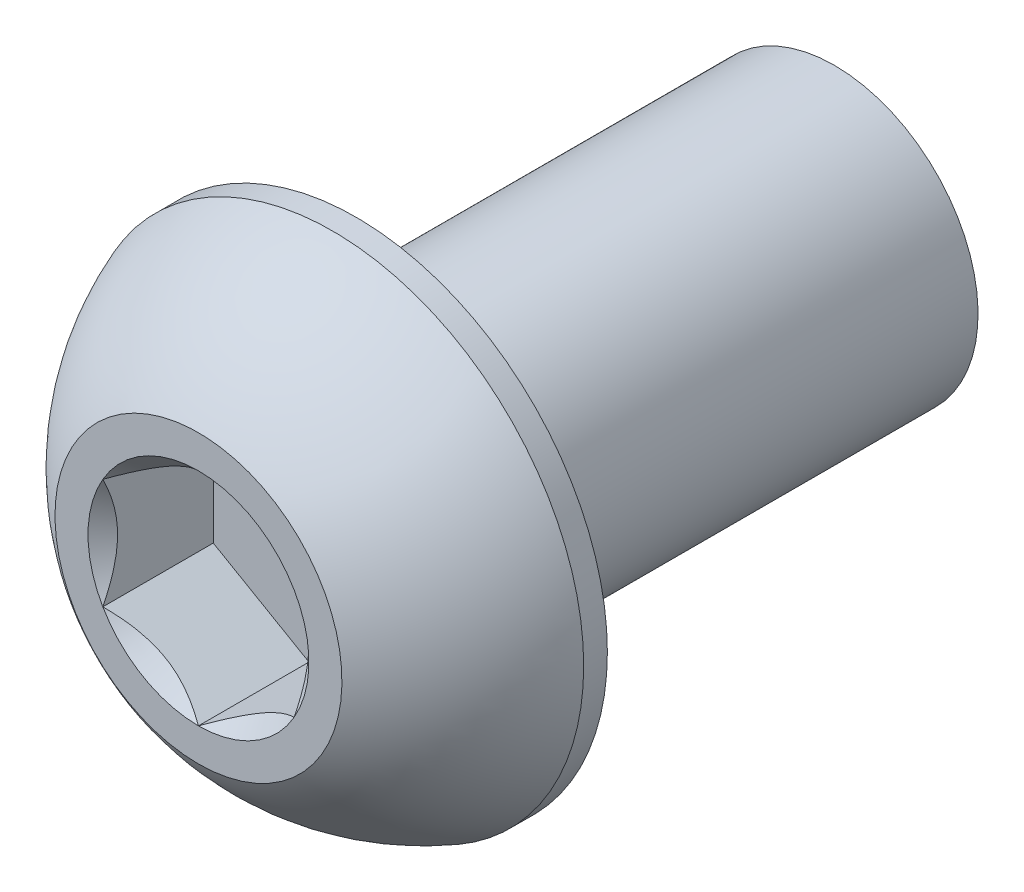
from build123d import *

# Parameters (mm, degrees)
SKETCH1_W              = 10
SKETCH1_H              = 3
CUT_EXTRUDE2_DEPTH     = 2.31
SPLIT1_SURFACE_1_BACK  = 20.935
SPLIT1_SURFACE_1_DEPTH = 41.87
SPLIT1_SURFACE_2_BACK  = 20.935
SPLIT1_SURFACE_2_DEPTH = 41.87


with BuildPart() as part:
    # Sketch1 → Revolve1 (revolve)
    with BuildSketch(Plane(origin=(0, 0, 0), x_dir=(0, 0, -1), z_dir=(1, 0, 0))):
        with Locations((8.3, 1.5)):
            Rectangle(SKETCH1_W, SKETCH1_H)
    revolve(axis=Axis((0, 0, -13.3), (0, 0, 1)))

    # Sketch7 → Revolve2 (revolve)
    with BuildSketch(Plane(origin=(0, 0, 0), x_dir=(0, 0, -1), z_dir=(1, 0, 0))):
        with BuildLine():
            Line((2.805, 5.25), (3.3, 5.25))
            Line((3.3, 5.25), (3.3, 0))
            Line((3.3, 0), (0, 0))
            Line((0, 0), (0, 3))
            ThreePointArc((0, 3), (1.216479019, 4.356906156), (2.805, 5.25))
        make_face()
    revolve(axis=Axis((0, 0, 0), (0, 0, -1)))

    # Sketch5 → Cut-Extrude2 (cut)
    with BuildSketch(Plane.XY):
        Polygon((2, -1.154700538), (2, 1.154700538), (0, 2.309401077), (-2, 1.154700538), (-2, -1.154700538), (0, -2.309401077), align=None)
    extrude(amount=-CUT_EXTRUDE2_DEPTH, mode=Mode.SUBTRACT)

    # Cut-Extrude3 cone 1 section (through the dimple's axis) → Cut-Extrude3 (revolve, cut)
    with BuildSketch(Plane(origin=(0, 0, 0), x_dir=(0, -1, 0), z_dir=(1, 0, 0))):
        Polygon((0, 0), (2.309401077, 0), (0, 2.309401077), align=None)
    revolve(axis=Axis((0, 0, 0), (0, 0, -1)), mode=Mode.SUBTRACT)


with BuildPart() as body_2:
    # Split1: the piece behind the surface
    add(part.part)
    # Split1 surface: a surface, the sketch's curves swept straight by 41.87 mm
    with BuildLine(Plane(origin=(0, 0, 0), x_dir=(0, 0, -1), z_dir=(1, 0, 0)).offset(-SPLIT1_SURFACE_1_BACK), mode=Mode.PRIVATE) as split1_surface_1_path:
        Line((3.3, -5.25), (3.3, 5.25))
    split1_surface_1 = Shell.extrude(split1_surface_1_path.wire(), (1 * SPLIT1_SURFACE_1_DEPTH, 0 * SPLIT1_SURFACE_1_DEPTH, 0 * SPLIT1_SURFACE_1_DEPTH))
    split(bisect_by=split1_surface_1, keep=Keep.BOTTOM)


with BuildPart() as part_1:
    add(part.part)

    # Split1: split by a surface, the side it looks to stays
    # Split1 surface: a surface, the sketch's curves swept straight by 41.87 mm
    with BuildLine(Plane(origin=(0, 0, 0), x_dir=(0, 0, -1), z_dir=(1, 0, 0)).offset(-SPLIT1_SURFACE_2_BACK), mode=Mode.PRIVATE) as split1_surface_2_path:
        Line((3.3, -5.25), (3.3, 5.25))
    split1_surface_2 = Shell.extrude(split1_surface_2_path.wire(), (1 * SPLIT1_SURFACE_2_DEPTH, 0 * SPLIT1_SURFACE_2_DEPTH, 0 * SPLIT1_SURFACE_2_DEPTH))
    split(bisect_by=split1_surface_2, keep=Keep.TOP)


solid = Compound([body_2.part, part_1.part])
